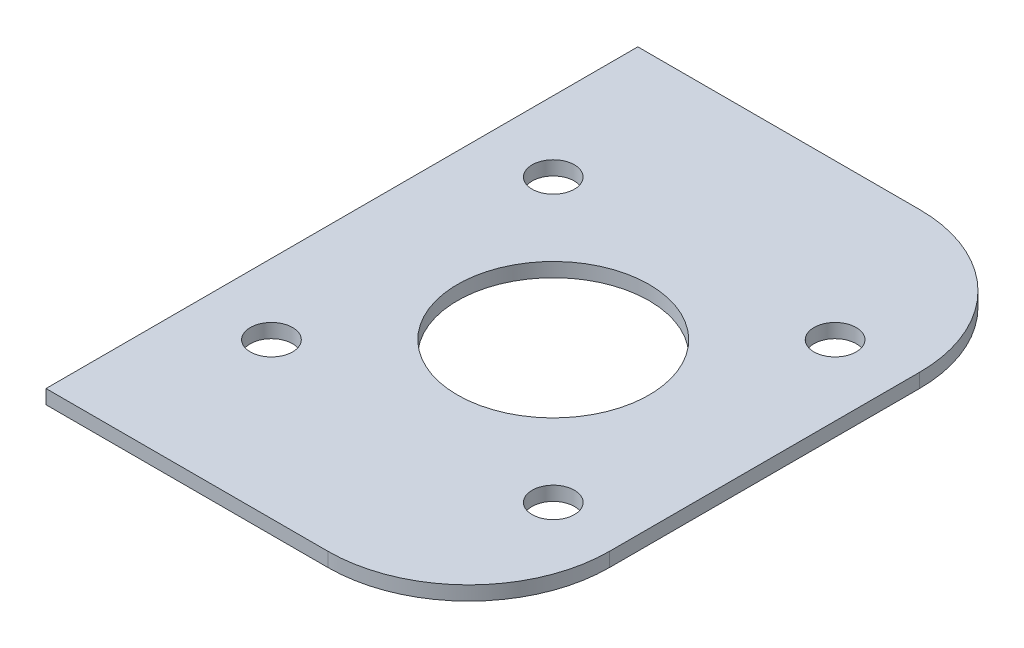
from build123d import *

# Parameters (mm, degrees)
SKETCH2_W           = 30
SKETCH2_H           = 42
SKETCH2_R           = 6.8
BOSS_EXTRUDE1_DEPTH = 1
FILLET1_R           = 10
SKETCH3_R           = 1.5
CUT_EXTRUDE1_DEPTH  = 1


with BuildPart() as part:
    # Sketch2 → Boss-Extrude1 (new body)
    with BuildSketch(Plane(origin=(0, 0, 0), x_dir=(1, 0, 0), z_dir=(0, 1, 0))):
        Rectangle(SKETCH2_W, SKETCH2_H)
        with Locations(Location((0, 0, 0), (0, 0, 270))):
            Circle(SKETCH2_R, mode=Mode.SUBTRACT)
    extrude(amount=BOSS_EXTRUDE1_DEPTH)

    # Fillet1
    fillet1_edges = [part.edges().sort_by_distance(p)[0] for p in [
        (15, 0.5, 21),
        (15, 0.5, -21),
    ]]
    fillet(fillet1_edges, radius=FILLET1_R)

    # Sketch3 → Cut-Extrude1 (cut)
    with BuildSketch(Plane(origin=(0, 1, 0), x_dir=(1, 0, 0), z_dir=(0, 1, 0))):
        with Locations(Location((-10, 10, 0), (0, 0, 270))):
            Circle(SKETCH3_R)
        with Locations(Location((10, 10, 0), (0, 0, 270))):
            Circle(SKETCH3_R)
        with Locations(Location((10, -10, 0), (0, 0, 270))):
            Circle(SKETCH3_R)
        with Locations(Location((-10, -10, 0), (0, 0, 270))):
            Circle(SKETCH3_R)
    extrude(amount=-CUT_EXTRUDE1_DEPTH, mode=Mode.SUBTRACT)


solid = part.part
